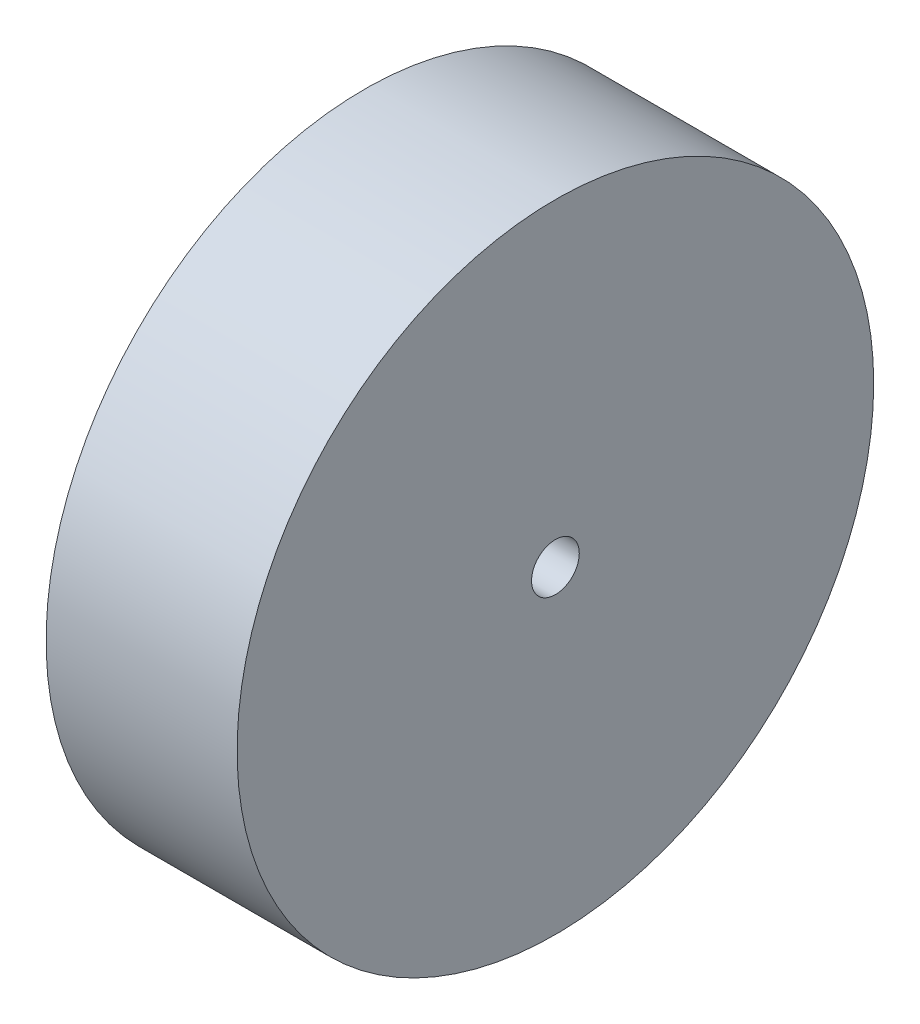
from build123d import *


with BuildPart() as part:
    # Esboço3 → Revolução1 (revolve)
    with BuildSketch(Plane.XY, mode=Mode.PRIVATE) as revolu_o1_sk:
        Polygon((0, 10), (0, 0.75), (-5, 0.75), (-5, 0), (-6, 0), (-6, 2), (-1, 2), (-1, 9), (-6, 9), (-6, 10), align=None)
    revolve(revolu_o1_sk.sketch.rotate(Axis((0, 0, 0), (-1, 0, 0)), 90), axis=Axis((0, 0, 0), (-1, 0, 0)))


solid = part.part
